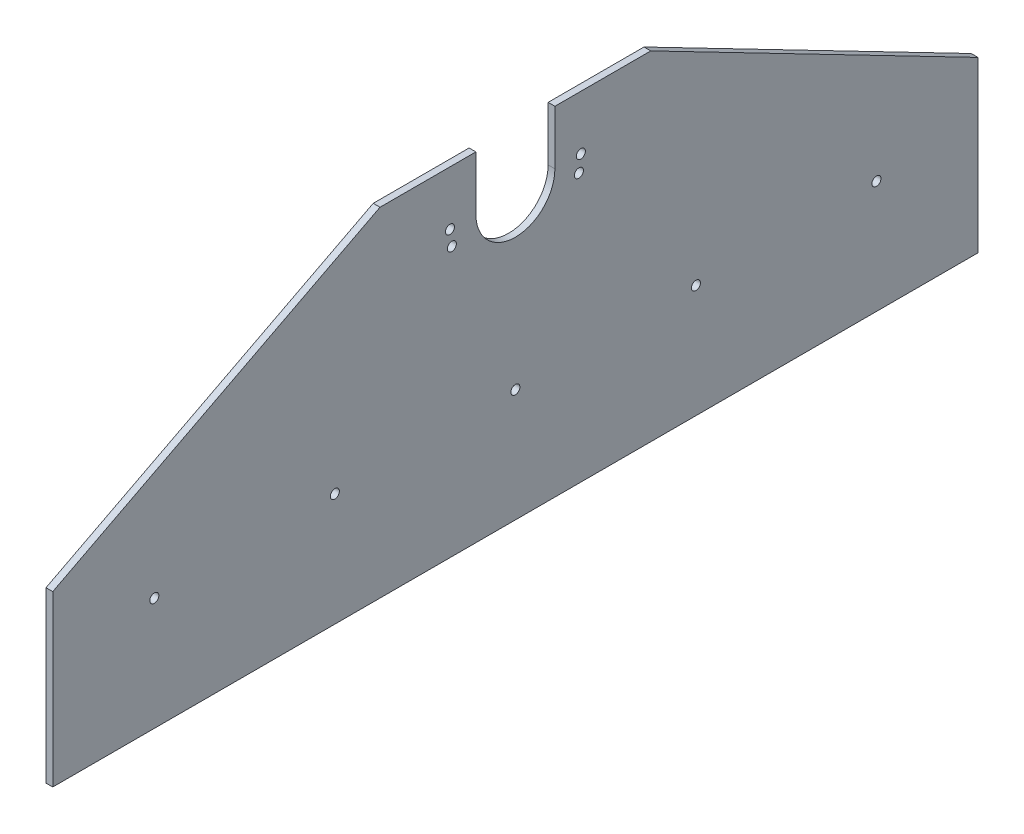
from build123d import *

# Parameters (mm, degrees)
SKETCH1_W           = 410
SKETCH1_H           = 150
BOSS_EXTRUDE1_DEPTH = 3
CUT_EXTRUDE1_DEPTH  = 3
SKETCH3_R           = 2
CUT_EXTRUDE2_DEPTH  = 3
SKETCH4_R           = 2
SKETCH4_R_2         = 17.5
CUT_EXTRUDE3_DEPTH  = 10
SKETCH5_W           = 35
SKETCH5_H           = 24
CUT_EXTRUDE4_DEPTH  = 10


with BuildPart() as part:
    # Sketch1 → Boss-Extrude1 (new body)
    with BuildSketch(Plane(origin=(0, 0, 0), x_dir=(0, 0, -1), z_dir=(1, 0, 0))):
        with Locations((205, 75)):
            Rectangle(SKETCH1_W, SKETCH1_H)
    extrude(amount=BOSS_EXTRUDE1_DEPTH)

    # Sketch2 → Cut-Extrude1 (cut)
    with BuildSketch(Plane(origin=(3, 0, 0), x_dir=(0, 0, -1), z_dir=(1, 0, 0))):
        Polygon((145, 150), (0, 75), (0, 150), align=None)
        Polygon((265, 150), (410, 75), (410, 150), align=None)
    extrude(amount=-CUT_EXTRUDE1_DEPTH, mode=Mode.SUBTRACT)

    # Sketch3 → Cut-Extrude2 (cut)
    with BuildSketch(Plane(origin=(3, 0, 0), x_dir=(0, 0, -1), z_dir=(1, 0, 0))):
        with Locations((45, 50)):
            Circle(SKETCH3_R)
        with Locations((125, 50)):
            Circle(SKETCH3_R)
        with Locations((205, 50)):
            Circle(SKETCH3_R)
        with Locations((285, 50)):
            Circle(SKETCH3_R)
        with Locations((365, 50)):
            Circle(SKETCH3_R)
    extrude(amount=-CUT_EXTRUDE2_DEPTH, mode=Mode.SUBTRACT)

    # Sketch4 → Cut-Extrude3 (cut)
    with BuildSketch(Plane(origin=(3, 0, 0), x_dir=(0, 0, -1), z_dir=(1, 0, 0))):
        with Locations((176, 126)):
            Circle(SKETCH4_R)
        with Locations((176.845, 119.051188951)):
            Circle(SKETCH4_R)
        with Locations((205, 126)):
            Circle(SKETCH4_R_2)
        with Locations(Location((233.155, 119.051188951, 0), (0, 0, 180))):
            Circle(SKETCH4_R)
        with Locations(Location((234, 126, 0), (0, 0, 180))):
            Circle(SKETCH4_R)
    extrude(amount=-CUT_EXTRUDE3_DEPTH, mode=Mode.SUBTRACT)

    # Sketch5 → Cut-Extrude4 (cut)
    with BuildSketch(Plane(origin=(3, 0, 0), x_dir=(0, 0, -1), z_dir=(1, 0, 0))):
        with Locations((205, 138)):
            Rectangle(SKETCH5_W, SKETCH5_H)
    extrude(amount=-CUT_EXTRUDE4_DEPTH, mode=Mode.SUBTRACT)


solid = part.part
